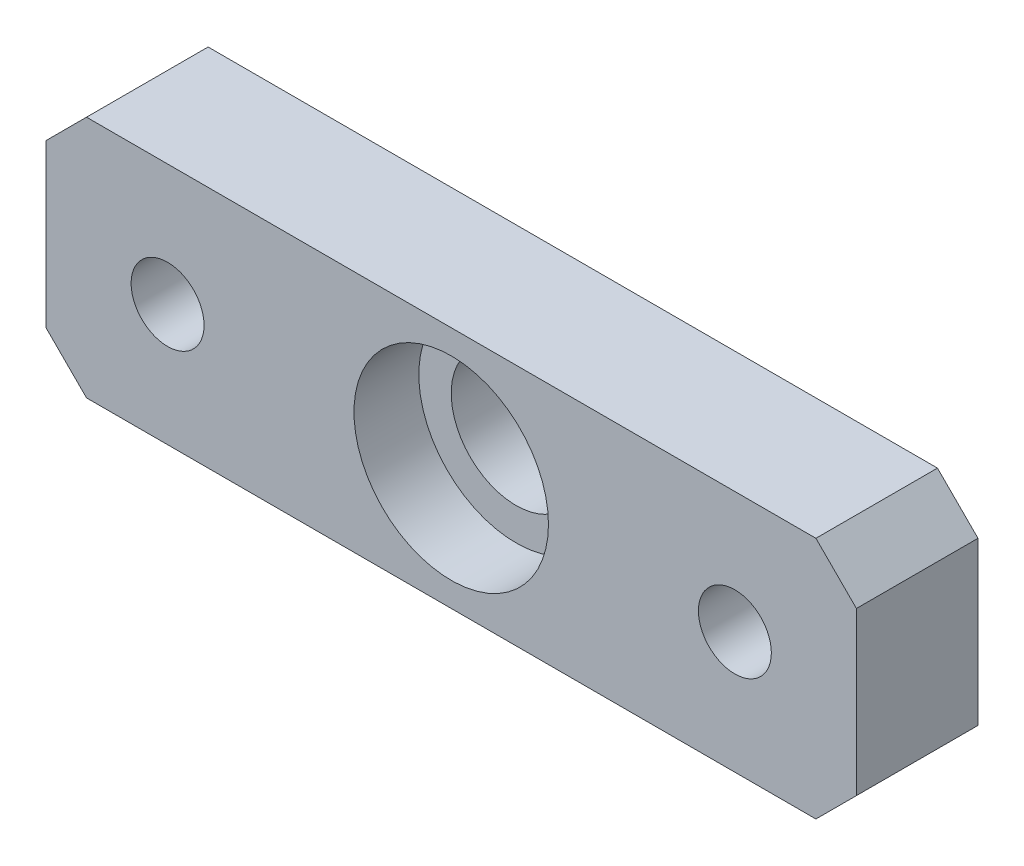
from build123d import *

# Parameters (mm, degrees)
SKETCH_1_W          = 100
SKETCH_1_H          = 30
SKETCH_1_R          = 4.5
SKETCH_1_R_2        = 8
EXTRUDE_1_DEPTH     = 15
SKETCH_2_R          = 12
CUT_EXTRUDE_1_DEPTH = 8
SKETCH_3_R          = 6.5
CUT_EXTRUDE_2_DEPTH = 8
CHAMFER_1_SIZE      = 5


with BuildPart() as part:
    # 草图1 → 凸台-拉伸1 (new body)
    with BuildSketch(Plane.XY):
        with Locations((50, 15)):
            Rectangle(SKETCH_1_W, SKETCH_1_H)
        with Locations((15, 15)):
            Circle(SKETCH_1_R, mode=Mode.SUBTRACT)
        with Locations((50, 15)):
            Circle(SKETCH_1_R_2, mode=Mode.SUBTRACT)
        with Locations((85, 15)):
            Circle(SKETCH_1_R, mode=Mode.SUBTRACT)
    extrude(amount=EXTRUDE_1_DEPTH)

    # 草图2 → 切除-拉伸1 (cut)
    with BuildSketch(Plane.XY.offset(15)):
        with Locations((50, 15)):
            Circle(SKETCH_2_R)
    extrude(amount=-CUT_EXTRUDE_1_DEPTH, mode=Mode.SUBTRACT)

    # 草图3 → 切除-拉伸2 (cut)
    with BuildSketch(Plane(origin=(0, 0, 0), x_dir=(-1, 0, 0), z_dir=(0, 0, -1))):
        with Locations((-85, 15)):
            Circle(SKETCH_3_R)
        with Locations((-15, 15)):
            Circle(SKETCH_3_R)
    extrude(amount=-CUT_EXTRUDE_2_DEPTH, mode=Mode.SUBTRACT)

    # 倒角1
    chamfer_1_edges = [part.edges().sort_by_distance(p)[0] for p in [
        (0, 30, 7.5),
        (100, 30, 7.5),
        (100, 0, 7.5),
        (0, 0, 7.5),
    ]]
    chamfer(chamfer_1_edges, length=CHAMFER_1_SIZE)


solid = part.part
